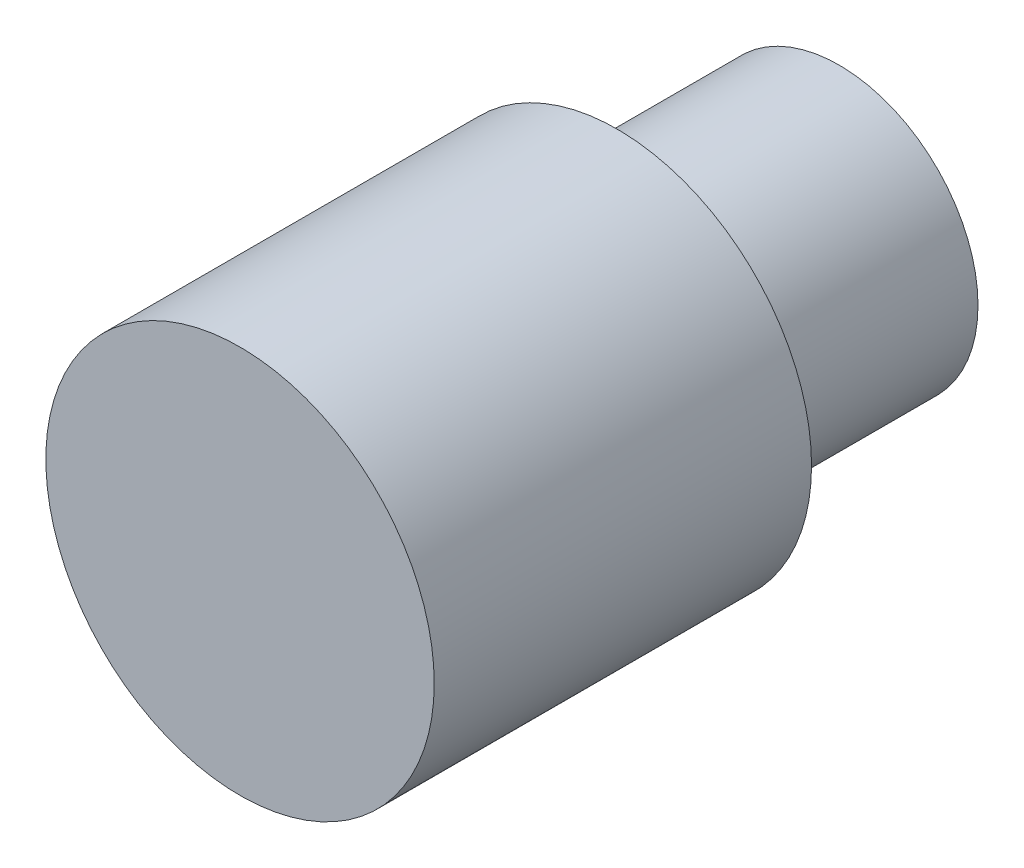
from build123d import *

# Parameters (mm, degrees)
SKETCH_1_R      = 12.5
EXTRUDE_1_DEPTH = 20
SKETCH_2_R      = 17.5
EXTRUDE_2_DEPTH = 34


with BuildPart() as part:
    # 草图1 → 凸台-拉伸1 (new body)
    with BuildSketch(Plane.XY):
        Circle(SKETCH_1_R)
    extrude(amount=EXTRUDE_1_DEPTH)

    # 草图2 → 凸台-拉伸2 (add)
    with BuildSketch(Plane.XY.offset(20)):
        Circle(SKETCH_2_R)
    extrude(amount=EXTRUDE_2_DEPTH)


solid = part.part
